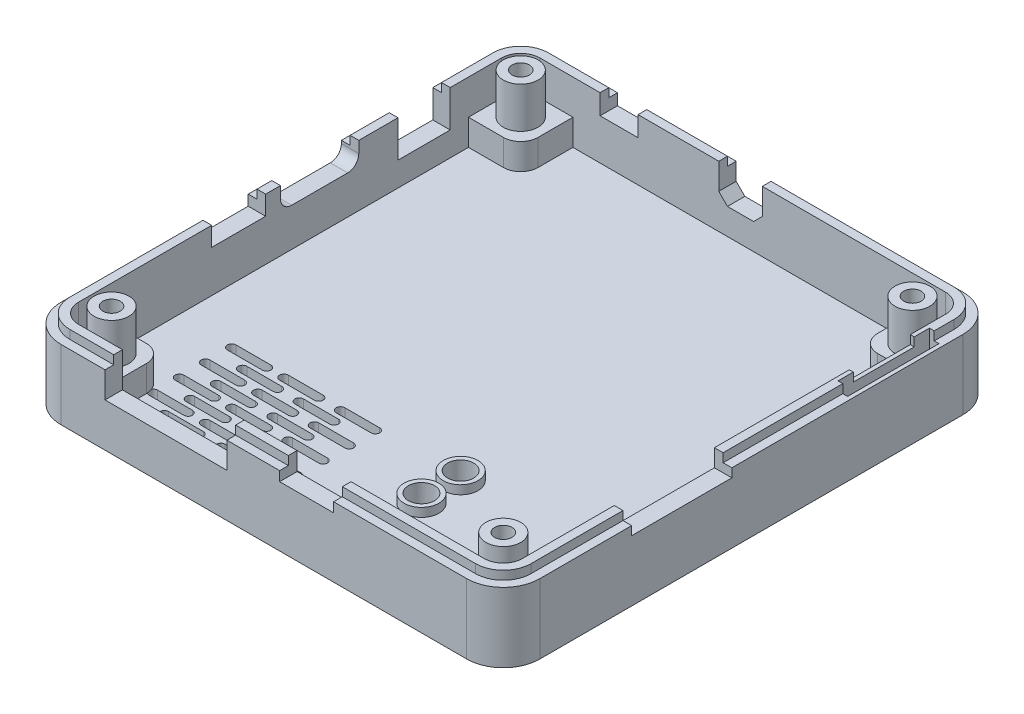
from build123d import *

# Parameters (mm, degrees)
BOSS_EXTRUDE1_DEPTH = 8
BOSS_EXTRUDE2_DEPTH = 9
BOSS_EXTRUDE3_DEPTH = 2
BOSS_EXTRUDE4_DEPTH = 5
SKETCH2_R           = 2
SKETCH2_R_2         = 1
BOSS_EXTRUDE5_DEPTH = 4.7
SKETCH3_W           = 6
SKETCH3_H           = 4.22
SKETCH3_W_2         = 6.2
SKETCH3_H_2         = 2.2
CUT_EXTRUDE1_DEPTH  = 2
SKETCH5_W           = 4.36
SKETCH5_H           = 2.3
CUT_EXTRUDE3_DEPTH  = 2
SKETCH6_W           = 1.1
SKETCH6_H           = 10.5
CUT_EXTRUDE4_DEPTH  = 3
SKETCH7_W           = 7
SKETCH7_H           = 1
SKETCH7_W_2         = 11.5
SKETCH7_H_2         = 2
CUT_EXTRUDE5_DEPTH  = 2
SKETCH9_W           = 14
SKETCH9_H           = 4
SKETCH9_W_2         = 6.2
SKETCH9_H_2         = 2.1
CUT_EXTRUDE6_DEPTH  = 2
SKETCH10_R          = 1.5
CUT_EXTRUDE7_DEPTH  = 2
CUT_EXTRUDE8_DEPTH  = 2
SKETCH12_R          = 2
SKETCH12_R_2        = 1.5
BOSS_EXTRUDE7_DEPTH = 1


with BuildPart() as part:
    # Sketch1 → Boss-Extrude1 (new body)
    with BuildSketch(Plane(origin=(0, 0, 0), x_dir=(1, 0, 0), z_dir=(0, 1, 0))):
        with BuildLine():
            Line((23.3, 28.5), (-23.3, 28.5))
            ThreePointArc((-23.3, 28.5), (-26.269848481, 27.269848481), (-27.5, 24.3))
            Line((-27.5, 24.3), (-27.5, -24.3))
            ThreePointArc((-27.5, -24.3), (-26.269848481, -27.269848481), (-23.3, -28.5))
            Line((-23.3, -28.5), (23.3, -28.5))
            ThreePointArc((23.3, -28.5), (26.269848481, -27.269848481), (27.5, -24.3))
            Line((27.5, -24.3), (27.5, 24.3))
            ThreePointArc((27.5, 24.3), (26.269848481, 27.269848481), (23.3, 28.5))
        make_face()
        with BuildLine():
            ThreePointArc((-26.5, 24.3), (-25.5627417, 26.5627417), (-23.3, 27.5))
            Line((-23.3, 27.5), (23.3, 27.5))
            ThreePointArc((23.3, 27.5), (25.5627417, 26.5627417), (26.5, 24.3))
            Line((26.5, 24.3), (26.5, -24.3))
            ThreePointArc((26.5, -24.3), (25.5627417, -26.5627417), (23.3, -27.5))
            Line((23.3, -27.5), (-23.3, -27.5))
            ThreePointArc((-23.3, -27.5), (-25.5627417, -26.5627417), (-26.5, -24.3))
            Line((-26.5, -24.3), (-26.5, 24.3))
        make_face(mode=Mode.SUBTRACT)
    extrude(amount=BOSS_EXTRUDE1_DEPTH)

    # Sketch1<3> → Boss-Extrude2 (add)
    with BuildSketch(Plane(origin=(0, 0, 0), x_dir=(1, 0, 0), z_dir=(0, 1, 0))):
        with BuildLine():
            Line((23.3, 27.5), (-23.3, 27.5))
            ThreePointArc((-23.3, 27.5), (-25.5627417, 26.5627417), (-26.5, 24.3))
            Line((-26.5, 24.3), (-26.5, -24.3))
            ThreePointArc((-26.5, -24.3), (-25.5627417, -26.5627417), (-23.3, -27.5))
            Line((-23.3, -27.5), (23.3, -27.5))
            ThreePointArc((23.3, -27.5), (25.5627417, -26.5627417), (26.5, -24.3))
            Line((26.5, -24.3), (26.5, 24.3))
            ThreePointArc((26.5, 24.3), (25.5627417, 26.5627417), (23.3, 27.5))
        make_face()
        with BuildLine():
            ThreePointArc((-25.5, 24.3), (-24.855634919, 25.855634919), (-23.3, 26.5))
            Line((-23.3, 26.5), (-19.5, 26.5))
            Line((-19.5, 26.5), (19.5, 26.5))
            Line((19.5, 26.5), (23.3, 26.5))
            ThreePointArc((23.3, 26.5), (24.855634919, 25.855634919), (25.5, 24.3))
            Line((25.5, 24.3), (25.5, 20.5))
            Line((25.5, 20.5), (25.5, -20.5))
            Line((25.5, -20.5), (25.5, -24.3))
            ThreePointArc((25.5, -24.3), (24.855634919, -25.855634919), (23.3, -26.5))
            Line((23.3, -26.5), (19.5, -26.5))
            Line((19.5, -26.5), (-19.5, -26.5))
            Line((-19.5, -26.5), (-23.3, -26.5))
            ThreePointArc((-23.3, -26.5), (-24.855634919, -25.855634919), (-25.5, -24.3))
            Line((-25.5, -24.3), (-25.5, -20.5))
            Line((-25.5, -20.5), (-25.5, 20.5))
            Line((-25.5, 20.5), (-25.5, 24.3))
        make_face(mode=Mode.SUBTRACT)
    extrude(amount=BOSS_EXTRUDE2_DEPTH)

    # Sketch1<4> → Boss-Extrude3 (add)
    with BuildSketch(Plane(origin=(0, 0, 0), x_dir=(1, 0, 0), z_dir=(0, 1, 0))):
        with BuildLine():
            Line((19.5, 26.5), (-19.5, 26.5))
            Line((-19.5, 26.5), (-19.5, 22.5))
            ThreePointArc((-19.5, 22.5), (-20.085786438, 21.085786438), (-21.5, 20.5))
            Line((-21.5, 20.5), (-25.5, 20.5))
            Line((-25.5, 20.5), (-25.5, -20.5))
            Line((-25.5, -20.5), (-21.5, -20.5))
            ThreePointArc((-21.5, -20.5), (-20.085786438, -21.085786438), (-19.5, -22.5))
            Line((-19.5, -22.5), (-19.5, -26.5))
            Line((-19.5, -26.5), (19.5, -26.5))
            Line((19.5, -26.5), (19.5, -22.5))
            ThreePointArc((19.5, -22.5), (20.085786438, -21.085786438), (21.5, -20.5))
            Line((21.5, -20.5), (25.5, -20.5))
            Line((25.5, -20.5), (25.5, 20.5))
            Line((25.5, 20.5), (21.5, 20.5))
            ThreePointArc((21.5, 20.5), (20.085786438, 21.085786438), (19.5, 22.5))
            Line((19.5, 22.5), (19.5, 26.5))
        make_face()
    extrude(amount=BOSS_EXTRUDE3_DEPTH)

    # Sketch1<5> → Boss-Extrude4 (add)
    with BuildSketch(Plane(origin=(0, 0, 0), x_dir=(1, 0, 0), z_dir=(0, 1, 0))):
        with BuildLine():
            Line((-19.5, 26.5), (-23.3, 26.5))
            ThreePointArc((-23.3, 26.5), (-24.855634919, 25.855634919), (-25.5, 24.3))
            Line((-25.5, 24.3), (-25.5, 20.5))
            Line((-25.5, 20.5), (-21.5, 20.5))
            ThreePointArc((-21.5, 20.5), (-20.085786438, 21.085786438), (-19.5, 22.5))
            Line((-19.5, 22.5), (-19.5, 26.5))
        make_face()
        with BuildLine():
            Line((23.3, 26.5), (19.5, 26.5))
            Line((19.5, 26.5), (19.5, 22.5))
            ThreePointArc((19.5, 22.5), (20.085786438, 21.085786438), (21.5, 20.5))
            Line((21.5, 20.5), (25.5, 20.5))
            Line((25.5, 20.5), (25.5, 24.3))
            ThreePointArc((25.5, 24.3), (24.855634919, 25.855634919), (23.3, 26.5))
        make_face()
        with BuildLine():
            Line((-21.5, -20.5), (-25.5, -20.5))
            Line((-25.5, -20.5), (-25.5, -24.3))
            ThreePointArc((-25.5, -24.3), (-24.855634919, -25.855634919), (-23.3, -26.5))
            Line((-23.3, -26.5), (-19.5, -26.5))
            Line((-19.5, -26.5), (-19.5, -22.5))
            ThreePointArc((-19.5, -22.5), (-20.085786438, -21.085786438), (-21.5, -20.5))
        make_face()
        with BuildLine():
            Line((25.5, -24.3), (25.5, -20.5))
            Line((25.5, -20.5), (21.5, -20.5))
            ThreePointArc((21.5, -20.5), (20.085786438, -21.085786438), (19.5, -22.5))
            Line((19.5, -22.5), (19.5, -26.5))
            Line((19.5, -26.5), (23.3, -26.5))
            ThreePointArc((23.3, -26.5), (24.855634919, -25.855634919), (25.5, -24.3))
        make_face()
    extrude(amount=BOSS_EXTRUDE4_DEPTH)

    # Sketch2 → Boss-Extrude5 (add)
    # profile 1 of 4: a face of its own
    with BuildSketch(Plane(origin=(0, 5, 0), x_dir=(1, 0, 0), z_dir=(0, 1, 0))):
        with Locations((-22.5, -23.5)):
            Circle(SKETCH2_R)
        with Locations((-22.5, -23.5)):
            Circle(SKETCH2_R_2, mode=Mode.SUBTRACT)
    # profile 2 of 4: a face of its own
    with BuildSketch(Plane(origin=(0, 5, 0), x_dir=(1, 0, 0), z_dir=(0, 1, 0))):
        with Locations((22.5, -23.5)):
            Circle(SKETCH2_R)
        with Locations((22.5, -23.5)):
            Circle(SKETCH2_R_2, mode=Mode.SUBTRACT)
    # profile 3 of 4: a face of its own
    with BuildSketch(Plane(origin=(0, 5, 0), x_dir=(1, 0, 0), z_dir=(0, 1, 0))):
        with Locations((22.5, 23.5)):
            Circle(SKETCH2_R)
        with Locations((22.5, 23.5)):
            Circle(SKETCH2_R_2, mode=Mode.SUBTRACT)
    # profile 4 of 4: a face of its own
    with BuildSketch(Plane(origin=(0, 5, 0), x_dir=(1, 0, 0), z_dir=(0, 1, 0))):
        with Locations((-22.5, 23.5)):
            Circle(SKETCH2_R)
        with Locations((-22.5, 23.5)):
            Circle(SKETCH2_R_2, mode=Mode.SUBTRACT)
    extrude(amount=BOSS_EXTRUDE5_DEPTH)

    # Sketch3 → Cut-Extrude1 (cut)
    with BuildSketch(Plane.ZY.offset(27.5)):
        with Locations((-15.4, 6.89)):
            Rectangle(SKETCH3_W, SKETCH3_H)
        with BuildLine():
            Line((-7.9, 9), (1.1, 9))
            Line((1.1, 9), (1.1, 7.68))
            ThreePointArc((1.1, 7.68), (0.72509668, 6.77490332), (-0.18, 6.4))
            Line((-0.18, 6.4), (-6.62, 6.4))
            ThreePointArc((-6.62, 6.4), (-7.52509668, 6.77490332), (-7.9, 7.68))
            Line((-7.9, 7.68), (-7.9, 9))
        make_face()
        with Locations((5.9, 7.9)):
            Rectangle(SKETCH3_W_2, SKETCH3_H_2)
    extrude(amount=-CUT_EXTRUDE1_DEPTH, mode=Mode.SUBTRACT)

    # Sketch5 → Cut-Extrude3 (cut)
    with BuildSketch(Plane(origin=(0, 0, -28.5), x_dir=(-1, 0, 0), z_dir=(0, 0, -1))):
        Polygon((1.75, 5), (-1.25, 5), (-2.25, 6), (-2.25, 9), (2.75, 9), (2.75, 6), align=None)
        with Locations((14.2, 7.85)):
            Rectangle(SKETCH5_W, SKETCH5_H)
    extrude(amount=-CUT_EXTRUDE3_DEPTH, mode=Mode.SUBTRACT)

    # Sketch6 → Cut-Extrude4 (cut)
    with BuildSketch(Plane(origin=(0, 9, 0), x_dir=(1, 0, 0), z_dir=(0, 1, 0))):
        with Locations((26.5, 16.75)):
            Rectangle(SKETCH6_W, SKETCH6_H)
    extrude(amount=-CUT_EXTRUDE4_DEPTH, mode=Mode.SUBTRACT)

    # Sketch7 → Cut-Extrude5 (cut)
    with BuildSketch(Plane(origin=(27.5, 0, 0), x_dir=(0, 0, -1), z_dir=(1, 0, 0))):
        with Locations((16.75, 8.5)):
            Rectangle(SKETCH7_W, SKETCH7_H)
        with Locations((-8, 8)):
            Rectangle(SKETCH7_W_2, SKETCH7_H_2)
    extrude(amount=-CUT_EXTRUDE5_DEPTH, mode=Mode.SUBTRACT)

    # Sketch9 → Cut-Extrude6 (cut)
    with BuildSketch(Plane.XY.offset(28.5)):
        with Locations((-11.25, 7)):
            Rectangle(SKETCH9_W, SKETCH9_H)
        with Locations((4.91, 7.95)):
            Rectangle(SKETCH9_W_2, SKETCH9_H_2)
    extrude(amount=-CUT_EXTRUDE6_DEPTH, mode=Mode.SUBTRACT)

    # Sketch10 → Cut-Extrude7 (cut)
    with BuildSketch(Plane.XZ):
        with Locations((7.2, 17.6)):
            Circle(SKETCH10_R)
        with Locations((7.2, 13.1)):
            Circle(SKETCH10_R)
    extrude(amount=-CUT_EXTRUDE7_DEPTH, mode=Mode.SUBTRACT)

    # Sketch11 → Cut-Extrude8 (cut)
    with BuildSketch(Plane.XZ):
        with BuildLine():
            Line((-13.2, 19.5), (-9.2, 19.5))
            ThreePointArc((-9.2, 19.5), (-8.7, 19), (-9.2, 18.5))
            Line((-9.2, 18.5), (-13.2, 18.5))
            ThreePointArc((-13.2, 18.5), (-13.7, 19), (-13.2, 19.5))
        make_face()
        with BuildLine():
            Line((-6.7, 19.5), (-2.7, 19.5))
            ThreePointArc((-2.7, 19.5), (-2.2, 19), (-2.7, 18.5))
            Line((-2.7, 18.5), (-6.7, 18.5))
            ThreePointArc((-6.7, 18.5), (-7.2, 19), (-6.7, 19.5))
        make_face()
        with BuildLine():
            Line((-19.2, 19.5), (-15.2, 19.5))
            ThreePointArc((-15.2, 19.5), (-14.7, 19), (-15.2, 18.5))
            Line((-15.2, 18.5), (-19.2, 18.5))
            ThreePointArc((-19.2, 18.5), (-19.7, 19), (-19.2, 19.5))
        make_face()
        with BuildLine():
            Line((-16.45, 21), (-12.45, 21))
            ThreePointArc((-12.45, 21), (-11.95, 20.5), (-12.45, 20))
            Line((-12.45, 20), (-16.45, 20))
            ThreePointArc((-16.45, 20), (-16.95, 20.5), (-16.45, 21))
        make_face()
        with BuildLine():
            Line((-9.95, 21), (-5.95, 21))
            ThreePointArc((-5.95, 21), (-5.45, 20.5), (-5.95, 20))
            Line((-5.95, 20), (-9.95, 20))
            ThreePointArc((-9.95, 20), (-10.45, 20.5), (-9.95, 21))
        make_face()
        with BuildLine():
            Line((-9.95, 18), (-5.95, 18))
            ThreePointArc((-5.95, 18), (-5.45, 17.5), (-5.95, 17))
            Line((-5.95, 17), (-9.95, 17))
            ThreePointArc((-9.95, 17), (-10.45, 17.5), (-9.95, 18))
        make_face()
        with BuildLine():
            Line((-16.45, 18), (-12.45, 18))
            ThreePointArc((-12.45, 18), (-11.95, 17.5), (-12.45, 17))
            Line((-12.45, 17), (-16.45, 17))
            ThreePointArc((-16.45, 17), (-16.95, 17.5), (-16.45, 18))
        make_face()
        with BuildLine():
            Line((-19.2, 22.5), (-15.2, 22.5))
            ThreePointArc((-15.2, 22.5), (-14.7, 22), (-15.2, 21.5))
            Line((-15.2, 21.5), (-19.2, 21.5))
            ThreePointArc((-19.2, 21.5), (-19.7, 22), (-19.2, 22.5))
        make_face()
        with BuildLine():
            Line((-6.7, 22.5), (-2.7, 22.5))
            ThreePointArc((-2.7, 22.5), (-2.2, 22), (-2.7, 21.5))
            Line((-2.7, 21.5), (-6.7, 21.5))
            ThreePointArc((-6.7, 21.5), (-7.2, 22), (-6.7, 22.5))
        make_face()
        with BuildLine():
            Line((-13.2, 22.5), (-9.2, 22.5))
            ThreePointArc((-9.2, 22.5), (-8.7, 22), (-9.2, 21.5))
            Line((-9.2, 21.5), (-13.2, 21.5))
            ThreePointArc((-13.2, 21.5), (-13.7, 22), (-13.2, 22.5))
        make_face()
        with BuildLine():
            Line((-19.2, 16.5), (-15.2, 16.5))
            ThreePointArc((-15.2, 16.5), (-14.7, 16), (-15.2, 15.5))
            Line((-15.2, 15.5), (-19.2, 15.5))
            ThreePointArc((-19.2, 15.5), (-19.7, 16), (-19.2, 16.5))
        make_face()
        with BuildLine():
            Line((-6.7, 16.5), (-2.7, 16.5))
            ThreePointArc((-2.7, 16.5), (-2.2, 16), (-2.7, 15.5))
            Line((-2.7, 15.5), (-6.7, 15.5))
            ThreePointArc((-6.7, 15.5), (-7.2, 16), (-6.7, 16.5))
        make_face()
        with BuildLine():
            Line((-13.2, 16.5), (-9.2, 16.5))
            ThreePointArc((-9.2, 16.5), (-8.7, 16), (-9.2, 15.5))
            Line((-9.2, 15.5), (-13.2, 15.5))
            ThreePointArc((-13.2, 15.5), (-13.7, 16), (-13.2, 16.5))
        make_face()
        with BuildLine():
            Line((-9.95, 24), (-5.95, 24))
            ThreePointArc((-5.95, 24), (-5.45, 23.5), (-5.95, 23))
            Line((-5.95, 23), (-9.95, 23))
            ThreePointArc((-9.95, 23), (-10.45, 23.5), (-9.95, 24))
        make_face()
        with BuildLine():
            Line((-16.45, 24), (-12.45, 24))
            ThreePointArc((-12.45, 24), (-11.95, 23.5), (-12.45, 23))
            Line((-12.45, 23), (-16.45, 23))
            ThreePointArc((-16.45, 23), (-16.95, 23.5), (-16.45, 24))
        make_face()
        with BuildLine():
            Line((-16.45, 15), (-12.45, 15))
            ThreePointArc((-12.45, 15), (-11.95, 14.5), (-12.45, 14))
            Line((-12.45, 14), (-16.45, 14))
            ThreePointArc((-16.45, 14), (-16.95, 14.5), (-16.45, 15))
        make_face()
        with BuildLine():
            Line((-9.95, 15), (-5.95, 15))
            ThreePointArc((-5.95, 15), (-5.45, 14.5), (-5.95, 14))
            Line((-5.95, 14), (-9.95, 14))
            ThreePointArc((-9.95, 14), (-10.45, 14.5), (-9.95, 15))
        make_face()
        with BuildLine():
            Line((-13.2, 25.5), (-9.2, 25.5))
            ThreePointArc((-9.2, 25.5), (-8.7, 25), (-9.2, 24.5))
            Line((-9.2, 24.5), (-13.2, 24.5))
            ThreePointArc((-13.2, 24.5), (-13.7, 25), (-13.2, 25.5))
        make_face()
        with BuildLine():
            Line((-6.7, 25.5), (-2.7, 25.5))
            ThreePointArc((-2.7, 25.5), (-2.2, 25), (-2.7, 24.5))
            Line((-2.7, 24.5), (-6.7, 24.5))
            ThreePointArc((-6.7, 24.5), (-7.2, 25), (-6.7, 25.5))
        make_face()
        with BuildLine():
            Line((-19.2, 25.5), (-15.2, 25.5))
            ThreePointArc((-15.2, 25.5), (-14.7, 25), (-15.2, 24.5))
            Line((-15.2, 24.5), (-19.2, 24.5))
            ThreePointArc((-19.2, 24.5), (-19.7, 25), (-19.2, 25.5))
        make_face()
        with BuildLine():
            Line((-13.2, 13.5), (-9.2, 13.5))
            ThreePointArc((-9.2, 13.5), (-8.7, 13), (-9.2, 12.5))
            Line((-9.2, 12.5), (-13.2, 12.5))
            ThreePointArc((-13.2, 12.5), (-13.7, 13), (-13.2, 13.5))
        make_face()
        with BuildLine():
            Line((-6.7, 13.5), (-2.7, 13.5))
            ThreePointArc((-2.7, 13.5), (-2.2, 13), (-2.7, 12.5))
            Line((-2.7, 12.5), (-6.7, 12.5))
            ThreePointArc((-6.7, 12.5), (-7.2, 13), (-6.7, 13.5))
        make_face()
        with BuildLine():
            Line((-19.2, 13.5), (-15.2, 13.5))
            ThreePointArc((-15.2, 13.5), (-14.7, 13), (-15.2, 12.5))
            Line((-15.2, 12.5), (-19.2, 12.5))
            ThreePointArc((-19.2, 12.5), (-19.7, 13), (-19.2, 13.5))
        make_face()
    extrude(amount=-CUT_EXTRUDE8_DEPTH, mode=Mode.SUBTRACT)

    # Sketch12 → Boss-Extrude7 (add)
    # profile 1 of 2: a face of its own
    with BuildSketch(Plane(origin=(0, 2, 0), x_dir=(1, 0, 0), z_dir=(0, 1, 0))):
        with Locations((7.2, -13.1)):
            Circle(SKETCH12_R)
        with Locations((7.2, -13.1)):
            Circle(SKETCH12_R_2, mode=Mode.SUBTRACT)
    # profile 2 of 2: a face of its own
    with BuildSketch(Plane(origin=(0, 2, 0), x_dir=(1, 0, 0), z_dir=(0, 1, 0))):
        with Locations((7.2, -17.6)):
            Circle(SKETCH12_R)
        with Locations((7.2, -17.6)):
            Circle(SKETCH12_R_2, mode=Mode.SUBTRACT)
    extrude(amount=BOSS_EXTRUDE7_DEPTH)


solid = part.part
